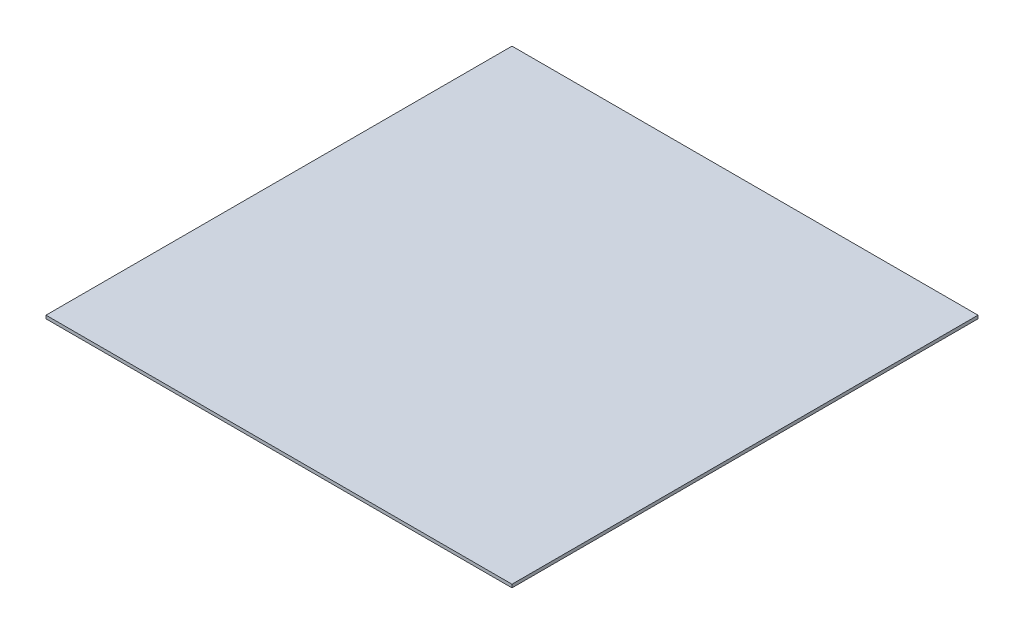
from build123d import *

# Parameters (mm, degrees)
SKETCH1_W           = 30
SKETCH1_H           = 30
BOSS_EXTRUDE1_DEPTH = 0.206


with BuildPart() as part:
    # Sketch1 → Boss-Extrude1 (new body)
    with BuildSketch(Plane(origin=(0, 0, 0), x_dir=(1, 0, 0), z_dir=(0, 1, 0))):
        Rectangle(SKETCH1_W, SKETCH1_H)
    extrude(amount=BOSS_EXTRUDE1_DEPTH)


solid = part.part
